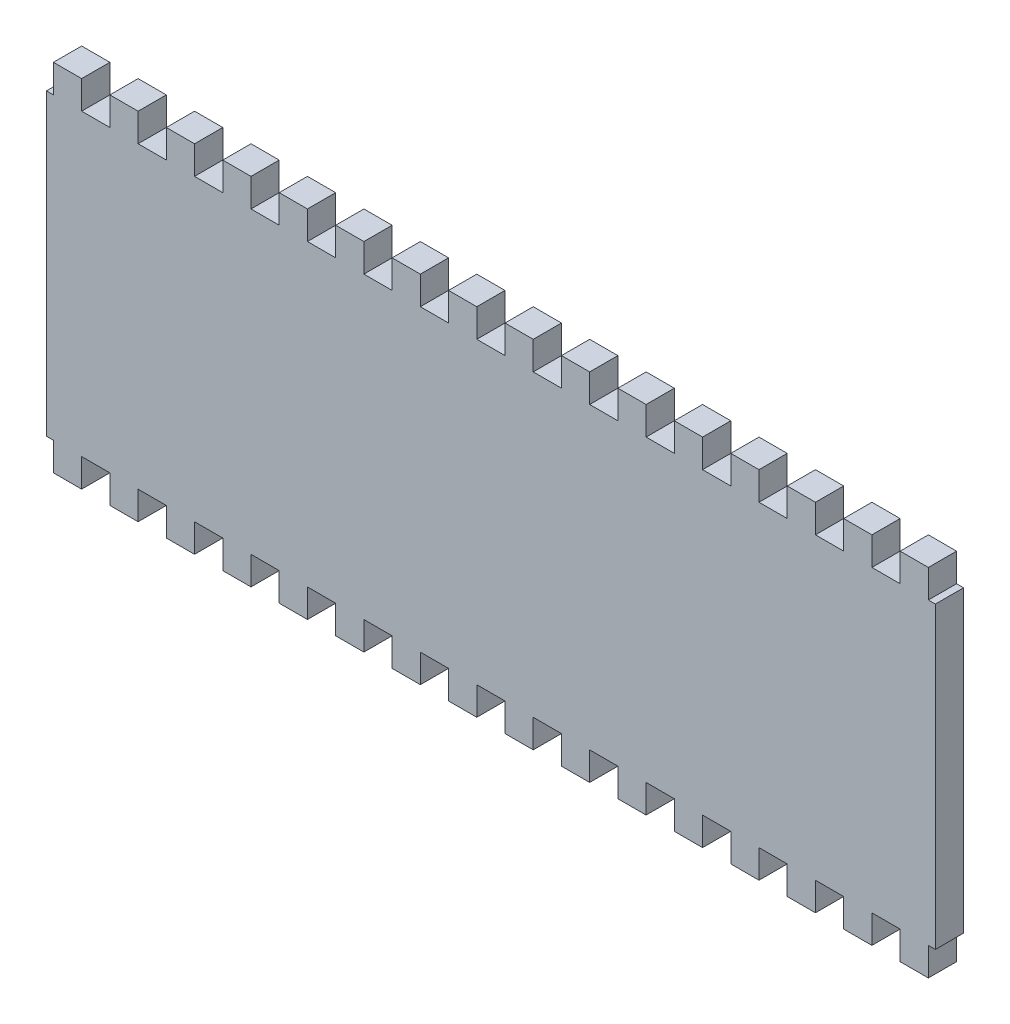
from build123d import *

# Parameters (mm, degrees)
SKETCH1_W                = 100
SKETCH1_H                = 40
BOSS_EXTRUDE1_DEPTH      = 3.175
SKETCH2_W                = 3.175
SKETCH2_H                = 6.35
CUT_EXTRUDE1_DEPTH       = 3.175
LPATTERN1_COUNT          = 10
LPATTERN1_PITCH          = 6.35
LPATTERN1_COUNT_DIR2     = 10
LPATTERN1_PITCH_DIR2     = 6.35
MIRROR1_COPY_1_SKETCH_W  = 3.175
MIRROR1_COPY_1_SKETCH_H  = 6.35
MIRROR1_COPY_1_DEPTH     = 3.175
MIRROR1_COPY_2_SKETCH_W  = 3.175
MIRROR1_COPY_2_SKETCH_H  = 6.35
MIRROR1_COPY_2_DEPTH     = 3.175
MIRROR1_COPY_3_SKETCH_W  = 3.175
MIRROR1_COPY_3_SKETCH_H  = 6.35
MIRROR1_COPY_3_DEPTH     = 3.175
MIRROR1_COPY_4_SKETCH_W  = 3.175
MIRROR1_COPY_4_SKETCH_H  = 6.35
MIRROR1_COPY_4_DEPTH     = 3.175
MIRROR1_COPY_5_SKETCH_W  = 3.175
MIRROR1_COPY_5_SKETCH_H  = 6.35
MIRROR1_COPY_5_DEPTH     = 3.175
MIRROR1_COPY_6_SKETCH_W  = 3.175
MIRROR1_COPY_6_SKETCH_H  = 6.35
MIRROR1_COPY_6_DEPTH     = 3.175
MIRROR1_COPY_7_SKETCH_W  = 3.175
MIRROR1_COPY_7_SKETCH_H  = 6.35
MIRROR1_COPY_7_DEPTH     = 3.175
MIRROR1_COPY_8_SKETCH_W  = 3.175
MIRROR1_COPY_8_SKETCH_H  = 6.35
MIRROR1_COPY_8_DEPTH     = 3.175
MIRROR1_COPY_9_SKETCH_W  = 3.175
MIRROR1_COPY_9_SKETCH_H  = 6.35
MIRROR1_COPY_9_DEPTH     = 3.175
MIRROR1_COPY_10_SKETCH_W = 3.175
MIRROR1_COPY_10_SKETCH_H = 6.35
MIRROR1_COPY_10_DEPTH    = 3.175
MIRROR1_COPY_11_SKETCH_W = 3.175
MIRROR1_COPY_11_SKETCH_H = 6.35
MIRROR1_COPY_11_DEPTH    = 3.175
MIRROR1_COPY_12_SKETCH_W = 3.175
MIRROR1_COPY_12_SKETCH_H = 6.35
MIRROR1_COPY_12_DEPTH    = 3.175
MIRROR1_COPY_13_SKETCH_W = 3.175
MIRROR1_COPY_13_SKETCH_H = 6.35
MIRROR1_COPY_13_DEPTH    = 3.175
MIRROR1_COPY_14_SKETCH_W = 3.175
MIRROR1_COPY_14_SKETCH_H = 6.35
MIRROR1_COPY_14_DEPTH    = 3.175
MIRROR1_COPY_15_SKETCH_W = 3.175
MIRROR1_COPY_15_SKETCH_H = 6.35
MIRROR1_COPY_15_DEPTH    = 3.175
MIRROR1_COPY_16_SKETCH_W = 3.175
MIRROR1_COPY_16_SKETCH_H = 6.35
MIRROR1_COPY_16_DEPTH    = 3.175
MIRROR1_COPY_17_SKETCH_W = 3.175
MIRROR1_COPY_17_SKETCH_H = 6.35
MIRROR1_COPY_17_DEPTH    = 3.175
MIRROR1_COPY_18_SKETCH_W = 3.175
MIRROR1_COPY_18_SKETCH_H = 6.35
MIRROR1_COPY_18_DEPTH    = 3.175
MIRROR1_COPY_19_SKETCH_W = 3.175
MIRROR1_COPY_19_SKETCH_H = 6.35
MIRROR1_COPY_19_DEPTH    = 3.175
MIRROR1_COPY_20_SKETCH_W = 3.175
MIRROR1_COPY_20_SKETCH_H = 6.35
MIRROR1_COPY_20_DEPTH    = 3.175
MIRROR1_COPY_21_SKETCH_W = 3.175
MIRROR1_COPY_21_SKETCH_H = 6.35
MIRROR1_COPY_21_DEPTH    = 3.175
MIRROR1_COPY_22_SKETCH_W = 3.175
MIRROR1_COPY_22_SKETCH_H = 6.35
MIRROR1_COPY_22_DEPTH    = 3.175
MIRROR1_COPY_23_SKETCH_W = 3.175
MIRROR1_COPY_23_SKETCH_H = 6.35
MIRROR1_COPY_23_DEPTH    = 3.175
MIRROR1_COPY_24_SKETCH_W = 3.175
MIRROR1_COPY_24_SKETCH_H = 6.35
MIRROR1_COPY_24_DEPTH    = 3.175
MIRROR1_COPY_25_SKETCH_W = 3.175
MIRROR1_COPY_25_SKETCH_H = 6.35
MIRROR1_COPY_25_DEPTH    = 3.175
MIRROR1_COPY_26_SKETCH_W = 3.175
MIRROR1_COPY_26_SKETCH_H = 6.35
MIRROR1_COPY_26_DEPTH    = 3.175
MIRROR1_COPY_27_SKETCH_W = 3.175
MIRROR1_COPY_27_SKETCH_H = 6.35
MIRROR1_COPY_27_DEPTH    = 3.175
MIRROR1_COPY_28_SKETCH_W = 3.175
MIRROR1_COPY_28_SKETCH_H = 6.35
MIRROR1_COPY_28_DEPTH    = 3.175
MIRROR1_COPY_29_SKETCH_W = 3.175
MIRROR1_COPY_29_SKETCH_H = 6.35
MIRROR1_COPY_29_DEPTH    = 3.175
MIRROR1_COPY_30_SKETCH_W = 3.175
MIRROR1_COPY_30_SKETCH_H = 6.35
MIRROR1_COPY_30_DEPTH    = 3.175
MIRROR1_COPY_31_SKETCH_W = 3.175
MIRROR1_COPY_31_SKETCH_H = 6.35
MIRROR1_COPY_31_DEPTH    = 3.175
MIRROR1_COPY_32_SKETCH_W = 3.175
MIRROR1_COPY_32_SKETCH_H = 6.35
MIRROR1_COPY_32_DEPTH    = 3.175
MIRROR1_COPY_33_SKETCH_W = 3.175
MIRROR1_COPY_33_SKETCH_H = 6.35
MIRROR1_COPY_33_DEPTH    = 3.175
MIRROR1_COPY_34_SKETCH_W = 3.175
MIRROR1_COPY_34_SKETCH_H = 6.35
MIRROR1_COPY_34_DEPTH    = 3.175
MIRROR1_COPY_35_SKETCH_W = 3.175
MIRROR1_COPY_35_SKETCH_H = 6.35
MIRROR1_COPY_35_DEPTH    = 3.175
MIRROR1_COPY_36_SKETCH_W = 3.175
MIRROR1_COPY_36_SKETCH_H = 6.35
MIRROR1_COPY_36_DEPTH    = 3.175
MIRROR1_COPY_37_SKETCH_W = 3.175
MIRROR1_COPY_37_SKETCH_H = 6.35
MIRROR1_COPY_37_DEPTH    = 3.175
MIRROR1_COPY_38_SKETCH_W = 3.175
MIRROR1_COPY_38_SKETCH_H = 6.35
MIRROR1_COPY_38_DEPTH    = 3.175
MIRROR1_COPY_39_SKETCH_W = 3.175
MIRROR1_COPY_39_SKETCH_H = 6.35
MIRROR1_COPY_39_DEPTH    = 3.175
MIRROR1_COPY_40_SKETCH_W = 3.175
MIRROR1_COPY_40_SKETCH_H = 6.35
MIRROR1_COPY_40_DEPTH    = 3.175
MIRROR1_COPY_41_SKETCH_W = 3.175
MIRROR1_COPY_41_SKETCH_H = 6.35
MIRROR1_COPY_41_DEPTH    = 3.175
MIRROR1_COPY_42_SKETCH_W = 3.175
MIRROR1_COPY_42_SKETCH_H = 6.35
MIRROR1_COPY_42_DEPTH    = 3.175
MIRROR1_COPY_43_SKETCH_W = 3.175
MIRROR1_COPY_43_SKETCH_H = 6.35
MIRROR1_COPY_43_DEPTH    = 3.175
MIRROR1_COPY_44_SKETCH_W = 3.175
MIRROR1_COPY_44_SKETCH_H = 6.35
MIRROR1_COPY_44_DEPTH    = 3.175
MIRROR1_COPY_45_SKETCH_W = 3.175
MIRROR1_COPY_45_SKETCH_H = 6.35
MIRROR1_COPY_45_DEPTH    = 3.175
MIRROR1_COPY_46_SKETCH_W = 3.175
MIRROR1_COPY_46_SKETCH_H = 6.35
MIRROR1_COPY_46_DEPTH    = 3.175
MIRROR1_COPY_47_SKETCH_W = 3.175
MIRROR1_COPY_47_SKETCH_H = 6.35
MIRROR1_COPY_47_DEPTH    = 3.175
MIRROR1_COPY_48_SKETCH_W = 3.175
MIRROR1_COPY_48_SKETCH_H = 6.35
MIRROR1_COPY_48_DEPTH    = 3.175
MIRROR1_COPY_49_SKETCH_W = 3.175
MIRROR1_COPY_49_SKETCH_H = 6.35
MIRROR1_COPY_49_DEPTH    = 3.175
MIRROR1_COPY_50_SKETCH_W = 3.175
MIRROR1_COPY_50_SKETCH_H = 6.35
MIRROR1_COPY_50_DEPTH    = 3.175
MIRROR1_COPY_51_SKETCH_W = 3.175
MIRROR1_COPY_51_SKETCH_H = 6.35
MIRROR1_COPY_51_DEPTH    = 3.175
MIRROR1_COPY_52_SKETCH_W = 3.175
MIRROR1_COPY_52_SKETCH_H = 6.35
MIRROR1_COPY_52_DEPTH    = 3.175
MIRROR1_COPY_53_SKETCH_W = 3.175
MIRROR1_COPY_53_SKETCH_H = 6.35
MIRROR1_COPY_53_DEPTH    = 3.175
MIRROR1_COPY_54_SKETCH_W = 3.175
MIRROR1_COPY_54_SKETCH_H = 6.35
MIRROR1_COPY_54_DEPTH    = 3.175
MIRROR1_COPY_55_SKETCH_W = 3.175
MIRROR1_COPY_55_SKETCH_H = 6.35
MIRROR1_COPY_55_DEPTH    = 3.175
MIRROR1_COPY_56_SKETCH_W = 3.175
MIRROR1_COPY_56_SKETCH_H = 6.35
MIRROR1_COPY_56_DEPTH    = 3.175
MIRROR1_COPY_57_SKETCH_W = 3.175
MIRROR1_COPY_57_SKETCH_H = 6.35
MIRROR1_COPY_57_DEPTH    = 3.175
MIRROR1_COPY_58_SKETCH_W = 3.175
MIRROR1_COPY_58_SKETCH_H = 6.35
MIRROR1_COPY_58_DEPTH    = 3.175
MIRROR1_COPY_59_SKETCH_W = 3.175
MIRROR1_COPY_59_SKETCH_H = 6.35
MIRROR1_COPY_59_DEPTH    = 3.175
MIRROR1_COPY_60_SKETCH_W = 3.175
MIRROR1_COPY_60_SKETCH_H = 6.35
MIRROR1_COPY_60_DEPTH    = 3.175
MIRROR1_COPY_61_SKETCH_W = 3.175
MIRROR1_COPY_61_SKETCH_H = 6.35
MIRROR1_COPY_61_DEPTH    = 3.175
MIRROR1_COPY_62_SKETCH_W = 3.175
MIRROR1_COPY_62_SKETCH_H = 6.35
MIRROR1_COPY_62_DEPTH    = 3.175
MIRROR1_COPY_63_SKETCH_W = 3.175
MIRROR1_COPY_63_SKETCH_H = 6.35
MIRROR1_COPY_63_DEPTH    = 3.175
MIRROR1_COPY_64_SKETCH_W = 3.175
MIRROR1_COPY_64_SKETCH_H = 6.35
MIRROR1_COPY_64_DEPTH    = 3.175
MIRROR1_COPY_65_SKETCH_W = 3.175
MIRROR1_COPY_65_SKETCH_H = 6.35
MIRROR1_COPY_65_DEPTH    = 3.175
MIRROR1_COPY_66_SKETCH_W = 3.175
MIRROR1_COPY_66_SKETCH_H = 6.35
MIRROR1_COPY_66_DEPTH    = 3.175
MIRROR1_COPY_67_SKETCH_W = 3.175
MIRROR1_COPY_67_SKETCH_H = 6.35
MIRROR1_COPY_67_DEPTH    = 3.175
MIRROR1_COPY_68_SKETCH_W = 3.175
MIRROR1_COPY_68_SKETCH_H = 6.35
MIRROR1_COPY_68_DEPTH    = 3.175
MIRROR1_COPY_69_SKETCH_W = 3.175
MIRROR1_COPY_69_SKETCH_H = 6.35
MIRROR1_COPY_69_DEPTH    = 3.175
MIRROR1_COPY_70_SKETCH_W = 3.175
MIRROR1_COPY_70_SKETCH_H = 6.35
MIRROR1_COPY_70_DEPTH    = 3.175
MIRROR1_COPY_71_SKETCH_W = 3.175
MIRROR1_COPY_71_SKETCH_H = 6.35
MIRROR1_COPY_71_DEPTH    = 3.175
MIRROR1_COPY_72_SKETCH_W = 3.175
MIRROR1_COPY_72_SKETCH_H = 6.35
MIRROR1_COPY_72_DEPTH    = 3.175
MIRROR1_COPY_73_SKETCH_W = 3.175
MIRROR1_COPY_73_SKETCH_H = 6.35
MIRROR1_COPY_73_DEPTH    = 3.175
MIRROR1_COPY_74_SKETCH_W = 3.175
MIRROR1_COPY_74_SKETCH_H = 6.35
MIRROR1_COPY_74_DEPTH    = 3.175
MIRROR1_COPY_75_SKETCH_W = 3.175
MIRROR1_COPY_75_SKETCH_H = 6.35
MIRROR1_COPY_75_DEPTH    = 3.175
MIRROR1_COPY_76_SKETCH_W = 3.175
MIRROR1_COPY_76_SKETCH_H = 6.35
MIRROR1_COPY_76_DEPTH    = 3.175
MIRROR1_COPY_77_SKETCH_W = 3.175
MIRROR1_COPY_77_SKETCH_H = 6.35
MIRROR1_COPY_77_DEPTH    = 3.175
MIRROR1_COPY_78_SKETCH_W = 3.175
MIRROR1_COPY_78_SKETCH_H = 6.35
MIRROR1_COPY_78_DEPTH    = 3.175
MIRROR1_COPY_79_SKETCH_W = 3.175
MIRROR1_COPY_79_SKETCH_H = 6.35
MIRROR1_COPY_79_DEPTH    = 3.175
MIRROR1_COPY_80_SKETCH_W = 3.175
MIRROR1_COPY_80_SKETCH_H = 6.35
MIRROR1_COPY_80_DEPTH    = 3.175
MIRROR1_COPY_81_SKETCH_W = 3.175
MIRROR1_COPY_81_SKETCH_H = 6.35
MIRROR1_COPY_81_DEPTH    = 3.175
MIRROR1_COPY_82_SKETCH_W = 3.175
MIRROR1_COPY_82_SKETCH_H = 6.35
MIRROR1_COPY_82_DEPTH    = 3.175
MIRROR1_COPY_83_SKETCH_W = 3.175
MIRROR1_COPY_83_SKETCH_H = 6.35
MIRROR1_COPY_83_DEPTH    = 3.175
MIRROR1_COPY_84_SKETCH_W = 3.175
MIRROR1_COPY_84_SKETCH_H = 6.35
MIRROR1_COPY_84_DEPTH    = 3.175
MIRROR1_COPY_85_SKETCH_W = 3.175
MIRROR1_COPY_85_SKETCH_H = 6.35
MIRROR1_COPY_85_DEPTH    = 3.175
MIRROR1_COPY_86_SKETCH_W = 3.175
MIRROR1_COPY_86_SKETCH_H = 6.35
MIRROR1_COPY_86_DEPTH    = 3.175
MIRROR1_COPY_87_SKETCH_W = 3.175
MIRROR1_COPY_87_SKETCH_H = 6.35
MIRROR1_COPY_87_DEPTH    = 3.175
MIRROR1_COPY_88_SKETCH_W = 3.175
MIRROR1_COPY_88_SKETCH_H = 6.35
MIRROR1_COPY_88_DEPTH    = 3.175
MIRROR1_COPY_89_SKETCH_W = 3.175
MIRROR1_COPY_89_SKETCH_H = 6.35
MIRROR1_COPY_89_DEPTH    = 3.175
MIRROR1_COPY_90_SKETCH_W = 3.175
MIRROR1_COPY_90_SKETCH_H = 6.35
MIRROR1_COPY_90_DEPTH    = 3.175
MIRROR1_COPY_91_SKETCH_W = 3.175
MIRROR1_COPY_91_SKETCH_H = 6.35
MIRROR1_COPY_91_DEPTH    = 3.175
MIRROR1_COPY_92_SKETCH_W = 3.175
MIRROR1_COPY_92_SKETCH_H = 6.35
MIRROR1_COPY_92_DEPTH    = 3.175
MIRROR1_COPY_93_SKETCH_W = 3.175
MIRROR1_COPY_93_SKETCH_H = 6.35
MIRROR1_COPY_93_DEPTH    = 3.175
MIRROR1_COPY_94_SKETCH_W = 3.175
MIRROR1_COPY_94_SKETCH_H = 6.35
MIRROR1_COPY_94_DEPTH    = 3.175
MIRROR1_COPY_95_SKETCH_W = 3.175
MIRROR1_COPY_95_SKETCH_H = 6.35
MIRROR1_COPY_95_DEPTH    = 3.175
MIRROR1_COPY_96_SKETCH_W = 3.175
MIRROR1_COPY_96_SKETCH_H = 6.35
MIRROR1_COPY_96_DEPTH    = 3.175
MIRROR1_COPY_97_SKETCH_W = 3.175
MIRROR1_COPY_97_SKETCH_H = 6.35
MIRROR1_COPY_97_DEPTH    = 3.175
MIRROR1_COPY_98_SKETCH_W = 3.175
MIRROR1_COPY_98_SKETCH_H = 6.35
MIRROR1_COPY_98_DEPTH    = 3.175
MIRROR1_COPY_99_SKETCH_W = 3.175
MIRROR1_COPY_99_SKETCH_H = 6.35
MIRROR1_COPY_99_DEPTH    = 3.175


with BuildPart() as part:
    # Sketch1 → Boss-Extrude1 (new body)
    with BuildSketch(Plane.XY):
        Rectangle(SKETCH1_W, SKETCH1_H)
    extrude(amount=BOSS_EXTRUDE1_DEPTH)

    # Sketch2 → Cut-Extrude1 (cut)
    with BuildSketch(Plane.XY.offset(3.175)):
        with Locations((0, -20)):
            Rectangle(SKETCH2_W, SKETCH2_H)
    cut_extrude1 = extrude(amount=-CUT_EXTRUDE1_DEPTH, mode=Mode.SUBTRACT)

    # LPattern1: Cut-Extrude1 10 × 10
    with Locations(*[Vector(1, 0, 0) * (i * LPATTERN1_PITCH) + Vector(-1, 0, 0) * (j * LPATTERN1_PITCH_DIR2) for i in range(LPATTERN1_COUNT) for j in range(LPATTERN1_COUNT_DIR2) if (i, j) != (0, 0)]):
        add(cut_extrude1, mode=Mode.SUBTRACT)

    # Mirror1: Cut-Extrude1 across plane
    add(cut_extrude1.mirror(Plane.ZX), mode=Mode.SUBTRACT)

    # Mirror1 copy 1 sketch → Mirror1 copy 1 (cut)
    with BuildSketch(Plane(origin=(-6.35, 0, 3.175), x_dir=(1, 0, 0), z_dir=(0, 0, 1))):
        with Locations((0, 20)):
            Rectangle(MIRROR1_COPY_1_SKETCH_W, MIRROR1_COPY_1_SKETCH_H)
    extrude(amount=-MIRROR1_COPY_1_DEPTH, mode=Mode.SUBTRACT)

    # Mirror1 copy 2 sketch → Mirror1 copy 2 (cut)
    with BuildSketch(Plane(origin=(-12.7, 0, 3.175), x_dir=(1, 0, 0), z_dir=(0, 0, 1))):
        with Locations((0, 20)):
            Rectangle(MIRROR1_COPY_2_SKETCH_W, MIRROR1_COPY_2_SKETCH_H)
    extrude(amount=-MIRROR1_COPY_2_DEPTH, mode=Mode.SUBTRACT)

    # Mirror1 copy 3 sketch → Mirror1 copy 3 (cut)
    with BuildSketch(Plane(origin=(-19.05, 0, 3.175), x_dir=(1, 0, 0), z_dir=(0, 0, 1))):
        with Locations((0, 20)):
            Rectangle(MIRROR1_COPY_3_SKETCH_W, MIRROR1_COPY_3_SKETCH_H)
    extrude(amount=-MIRROR1_COPY_3_DEPTH, mode=Mode.SUBTRACT)

    # Mirror1 copy 4 sketch → Mirror1 copy 4 (cut)
    with BuildSketch(Plane(origin=(-25.4, 0, 3.175), x_dir=(1, 0, 0), z_dir=(0, 0, 1))):
        with Locations((0, 20)):
            Rectangle(MIRROR1_COPY_4_SKETCH_W, MIRROR1_COPY_4_SKETCH_H)
    extrude(amount=-MIRROR1_COPY_4_DEPTH, mode=Mode.SUBTRACT)

    # Mirror1 copy 5 sketch → Mirror1 copy 5 (cut)
    with BuildSketch(Plane(origin=(-31.75, 0, 3.175), x_dir=(1, 0, 0), z_dir=(0, 0, 1))):
        with Locations((0, 20)):
            Rectangle(MIRROR1_COPY_5_SKETCH_W, MIRROR1_COPY_5_SKETCH_H)
    extrude(amount=-MIRROR1_COPY_5_DEPTH, mode=Mode.SUBTRACT)

    # Mirror1 copy 6 sketch → Mirror1 copy 6 (cut)
    with BuildSketch(Plane(origin=(-38.1, 0, 3.175), x_dir=(1, 0, 0), z_dir=(0, 0, 1))):
        with Locations((0, 20)):
            Rectangle(MIRROR1_COPY_6_SKETCH_W, MIRROR1_COPY_6_SKETCH_H)
    extrude(amount=-MIRROR1_COPY_6_DEPTH, mode=Mode.SUBTRACT)

    # Mirror1 copy 7 sketch → Mirror1 copy 7 (cut)
    with BuildSketch(Plane(origin=(-44.45, 0, 3.175), x_dir=(1, 0, 0), z_dir=(0, 0, 1))):
        with Locations((0, 20)):
            Rectangle(MIRROR1_COPY_7_SKETCH_W, MIRROR1_COPY_7_SKETCH_H)
    extrude(amount=-MIRROR1_COPY_7_DEPTH, mode=Mode.SUBTRACT)

    # Mirror1 copy 8 sketch → Mirror1 copy 8 (cut)
    with BuildSketch(Plane(origin=(-50.8, 0, 3.175), x_dir=(1, 0, 0), z_dir=(0, 0, 1))):
        with Locations((0, 20)):
            Rectangle(MIRROR1_COPY_8_SKETCH_W, MIRROR1_COPY_8_SKETCH_H)
    extrude(amount=-MIRROR1_COPY_8_DEPTH, mode=Mode.SUBTRACT)

    # Mirror1 copy 9 sketch → Mirror1 copy 9 (cut)
    with BuildSketch(Plane(origin=(-57.15, 0, 3.175), x_dir=(1, 0, 0), z_dir=(0, 0, 1))):
        with Locations((0, 20)):
            Rectangle(MIRROR1_COPY_9_SKETCH_W, MIRROR1_COPY_9_SKETCH_H)
    extrude(amount=-MIRROR1_COPY_9_DEPTH, mode=Mode.SUBTRACT)

    # Mirror1 copy 10 sketch → Mirror1 copy 10 (cut)
    with BuildSketch(Plane(origin=(6.35, 0, 3.175), x_dir=(1, 0, 0), z_dir=(0, 0, 1))):
        with Locations((0, 20)):
            Rectangle(MIRROR1_COPY_10_SKETCH_W, MIRROR1_COPY_10_SKETCH_H)
    extrude(amount=-MIRROR1_COPY_10_DEPTH, mode=Mode.SUBTRACT)

    # Mirror1 copy 11 sketch → Mirror1 copy 11 (cut)
    with BuildSketch(Plane.XY.offset(3.175)):
        with Locations((0, 20)):
            Rectangle(MIRROR1_COPY_11_SKETCH_W, MIRROR1_COPY_11_SKETCH_H)
    extrude(amount=-MIRROR1_COPY_11_DEPTH, mode=Mode.SUBTRACT)

    # Mirror1 copy 12 sketch → Mirror1 copy 12 (cut)
    with BuildSketch(Plane(origin=(-6.35, 0, 3.175), x_dir=(1, 0, 0), z_dir=(0, 0, 1))):
        with Locations((0, 20)):
            Rectangle(MIRROR1_COPY_12_SKETCH_W, MIRROR1_COPY_12_SKETCH_H)
    extrude(amount=-MIRROR1_COPY_12_DEPTH, mode=Mode.SUBTRACT)

    # Mirror1 copy 13 sketch → Mirror1 copy 13 (cut)
    with BuildSketch(Plane(origin=(-12.7, 0, 3.175), x_dir=(1, 0, 0), z_dir=(0, 0, 1))):
        with Locations((0, 20)):
            Rectangle(MIRROR1_COPY_13_SKETCH_W, MIRROR1_COPY_13_SKETCH_H)
    extrude(amount=-MIRROR1_COPY_13_DEPTH, mode=Mode.SUBTRACT)

    # Mirror1 copy 14 sketch → Mirror1 copy 14 (cut)
    with BuildSketch(Plane(origin=(-19.05, 0, 3.175), x_dir=(1, 0, 0), z_dir=(0, 0, 1))):
        with Locations((0, 20)):
            Rectangle(MIRROR1_COPY_14_SKETCH_W, MIRROR1_COPY_14_SKETCH_H)
    extrude(amount=-MIRROR1_COPY_14_DEPTH, mode=Mode.SUBTRACT)

    # Mirror1 copy 15 sketch → Mirror1 copy 15 (cut)
    with BuildSketch(Plane(origin=(-25.4, 0, 3.175), x_dir=(1, 0, 0), z_dir=(0, 0, 1))):
        with Locations((0, 20)):
            Rectangle(MIRROR1_COPY_15_SKETCH_W, MIRROR1_COPY_15_SKETCH_H)
    extrude(amount=-MIRROR1_COPY_15_DEPTH, mode=Mode.SUBTRACT)

    # Mirror1 copy 16 sketch → Mirror1 copy 16 (cut)
    with BuildSketch(Plane(origin=(-31.75, 0, 3.175), x_dir=(1, 0, 0), z_dir=(0, 0, 1))):
        with Locations((0, 20)):
            Rectangle(MIRROR1_COPY_16_SKETCH_W, MIRROR1_COPY_16_SKETCH_H)
    extrude(amount=-MIRROR1_COPY_16_DEPTH, mode=Mode.SUBTRACT)

    # Mirror1 copy 17 sketch → Mirror1 copy 17 (cut)
    with BuildSketch(Plane(origin=(-38.1, 0, 3.175), x_dir=(1, 0, 0), z_dir=(0, 0, 1))):
        with Locations((0, 20)):
            Rectangle(MIRROR1_COPY_17_SKETCH_W, MIRROR1_COPY_17_SKETCH_H)
    extrude(amount=-MIRROR1_COPY_17_DEPTH, mode=Mode.SUBTRACT)

    # Mirror1 copy 18 sketch → Mirror1 copy 18 (cut)
    with BuildSketch(Plane(origin=(-44.45, 0, 3.175), x_dir=(1, 0, 0), z_dir=(0, 0, 1))):
        with Locations((0, 20)):
            Rectangle(MIRROR1_COPY_18_SKETCH_W, MIRROR1_COPY_18_SKETCH_H)
    extrude(amount=-MIRROR1_COPY_18_DEPTH, mode=Mode.SUBTRACT)

    # Mirror1 copy 19 sketch → Mirror1 copy 19 (cut)
    with BuildSketch(Plane(origin=(-50.8, 0, 3.175), x_dir=(1, 0, 0), z_dir=(0, 0, 1))):
        with Locations((0, 20)):
            Rectangle(MIRROR1_COPY_19_SKETCH_W, MIRROR1_COPY_19_SKETCH_H)
    extrude(amount=-MIRROR1_COPY_19_DEPTH, mode=Mode.SUBTRACT)

    # Mirror1 copy 20 sketch → Mirror1 copy 20 (cut)
    with BuildSketch(Plane(origin=(12.7, 0, 3.175), x_dir=(1, 0, 0), z_dir=(0, 0, 1))):
        with Locations((0, 20)):
            Rectangle(MIRROR1_COPY_20_SKETCH_W, MIRROR1_COPY_20_SKETCH_H)
    extrude(amount=-MIRROR1_COPY_20_DEPTH, mode=Mode.SUBTRACT)

    # Mirror1 copy 21 sketch → Mirror1 copy 21 (cut)
    with BuildSketch(Plane(origin=(6.35, 0, 3.175), x_dir=(1, 0, 0), z_dir=(0, 0, 1))):
        with Locations((0, 20)):
            Rectangle(MIRROR1_COPY_21_SKETCH_W, MIRROR1_COPY_21_SKETCH_H)
    extrude(amount=-MIRROR1_COPY_21_DEPTH, mode=Mode.SUBTRACT)

    # Mirror1 copy 22 sketch → Mirror1 copy 22 (cut)
    with BuildSketch(Plane.XY.offset(3.175)):
        with Locations((0, 20)):
            Rectangle(MIRROR1_COPY_22_SKETCH_W, MIRROR1_COPY_22_SKETCH_H)
    extrude(amount=-MIRROR1_COPY_22_DEPTH, mode=Mode.SUBTRACT)

    # Mirror1 copy 23 sketch → Mirror1 copy 23 (cut)
    with BuildSketch(Plane(origin=(-6.35, 0, 3.175), x_dir=(1, 0, 0), z_dir=(0, 0, 1))):
        with Locations((0, 20)):
            Rectangle(MIRROR1_COPY_23_SKETCH_W, MIRROR1_COPY_23_SKETCH_H)
    extrude(amount=-MIRROR1_COPY_23_DEPTH, mode=Mode.SUBTRACT)

    # Mirror1 copy 24 sketch → Mirror1 copy 24 (cut)
    with BuildSketch(Plane(origin=(-12.7, 0, 3.175), x_dir=(1, 0, 0), z_dir=(0, 0, 1))):
        with Locations((0, 20)):
            Rectangle(MIRROR1_COPY_24_SKETCH_W, MIRROR1_COPY_24_SKETCH_H)
    extrude(amount=-MIRROR1_COPY_24_DEPTH, mode=Mode.SUBTRACT)

    # Mirror1 copy 25 sketch → Mirror1 copy 25 (cut)
    with BuildSketch(Plane(origin=(-19.05, 0, 3.175), x_dir=(1, 0, 0), z_dir=(0, 0, 1))):
        with Locations((0, 20)):
            Rectangle(MIRROR1_COPY_25_SKETCH_W, MIRROR1_COPY_25_SKETCH_H)
    extrude(amount=-MIRROR1_COPY_25_DEPTH, mode=Mode.SUBTRACT)

    # Mirror1 copy 26 sketch → Mirror1 copy 26 (cut)
    with BuildSketch(Plane(origin=(-25.4, 0, 3.175), x_dir=(1, 0, 0), z_dir=(0, 0, 1))):
        with Locations((0, 20)):
            Rectangle(MIRROR1_COPY_26_SKETCH_W, MIRROR1_COPY_26_SKETCH_H)
    extrude(amount=-MIRROR1_COPY_26_DEPTH, mode=Mode.SUBTRACT)

    # Mirror1 copy 27 sketch → Mirror1 copy 27 (cut)
    with BuildSketch(Plane(origin=(-31.75, 0, 3.175), x_dir=(1, 0, 0), z_dir=(0, 0, 1))):
        with Locations((0, 20)):
            Rectangle(MIRROR1_COPY_27_SKETCH_W, MIRROR1_COPY_27_SKETCH_H)
    extrude(amount=-MIRROR1_COPY_27_DEPTH, mode=Mode.SUBTRACT)

    # Mirror1 copy 28 sketch → Mirror1 copy 28 (cut)
    with BuildSketch(Plane(origin=(-38.1, 0, 3.175), x_dir=(1, 0, 0), z_dir=(0, 0, 1))):
        with Locations((0, 20)):
            Rectangle(MIRROR1_COPY_28_SKETCH_W, MIRROR1_COPY_28_SKETCH_H)
    extrude(amount=-MIRROR1_COPY_28_DEPTH, mode=Mode.SUBTRACT)

    # Mirror1 copy 29 sketch → Mirror1 copy 29 (cut)
    with BuildSketch(Plane(origin=(-44.45, 0, 3.175), x_dir=(1, 0, 0), z_dir=(0, 0, 1))):
        with Locations((0, 20)):
            Rectangle(MIRROR1_COPY_29_SKETCH_W, MIRROR1_COPY_29_SKETCH_H)
    extrude(amount=-MIRROR1_COPY_29_DEPTH, mode=Mode.SUBTRACT)

    # Mirror1 copy 30 sketch → Mirror1 copy 30 (cut)
    with BuildSketch(Plane(origin=(19.05, 0, 3.175), x_dir=(1, 0, 0), z_dir=(0, 0, 1))):
        with Locations((0, 20)):
            Rectangle(MIRROR1_COPY_30_SKETCH_W, MIRROR1_COPY_30_SKETCH_H)
    extrude(amount=-MIRROR1_COPY_30_DEPTH, mode=Mode.SUBTRACT)

    # Mirror1 copy 31 sketch → Mirror1 copy 31 (cut)
    with BuildSketch(Plane(origin=(12.7, 0, 3.175), x_dir=(1, 0, 0), z_dir=(0, 0, 1))):
        with Locations((0, 20)):
            Rectangle(MIRROR1_COPY_31_SKETCH_W, MIRROR1_COPY_31_SKETCH_H)
    extrude(amount=-MIRROR1_COPY_31_DEPTH, mode=Mode.SUBTRACT)

    # Mirror1 copy 32 sketch → Mirror1 copy 32 (cut)
    with BuildSketch(Plane(origin=(6.35, 0, 3.175), x_dir=(1, 0, 0), z_dir=(0, 0, 1))):
        with Locations((0, 20)):
            Rectangle(MIRROR1_COPY_32_SKETCH_W, MIRROR1_COPY_32_SKETCH_H)
    extrude(amount=-MIRROR1_COPY_32_DEPTH, mode=Mode.SUBTRACT)

    # Mirror1 copy 33 sketch → Mirror1 copy 33 (cut)
    with BuildSketch(Plane.XY.offset(3.175)):
        with Locations((0, 20)):
            Rectangle(MIRROR1_COPY_33_SKETCH_W, MIRROR1_COPY_33_SKETCH_H)
    extrude(amount=-MIRROR1_COPY_33_DEPTH, mode=Mode.SUBTRACT)

    # Mirror1 copy 34 sketch → Mirror1 copy 34 (cut)
    with BuildSketch(Plane(origin=(-6.35, 0, 3.175), x_dir=(1, 0, 0), z_dir=(0, 0, 1))):
        with Locations((0, 20)):
            Rectangle(MIRROR1_COPY_34_SKETCH_W, MIRROR1_COPY_34_SKETCH_H)
    extrude(amount=-MIRROR1_COPY_34_DEPTH, mode=Mode.SUBTRACT)

    # Mirror1 copy 35 sketch → Mirror1 copy 35 (cut)
    with BuildSketch(Plane(origin=(-12.7, 0, 3.175), x_dir=(1, 0, 0), z_dir=(0, 0, 1))):
        with Locations((0, 20)):
            Rectangle(MIRROR1_COPY_35_SKETCH_W, MIRROR1_COPY_35_SKETCH_H)
    extrude(amount=-MIRROR1_COPY_35_DEPTH, mode=Mode.SUBTRACT)

    # Mirror1 copy 36 sketch → Mirror1 copy 36 (cut)
    with BuildSketch(Plane(origin=(-19.05, 0, 3.175), x_dir=(1, 0, 0), z_dir=(0, 0, 1))):
        with Locations((0, 20)):
            Rectangle(MIRROR1_COPY_36_SKETCH_W, MIRROR1_COPY_36_SKETCH_H)
    extrude(amount=-MIRROR1_COPY_36_DEPTH, mode=Mode.SUBTRACT)

    # Mirror1 copy 37 sketch → Mirror1 copy 37 (cut)
    with BuildSketch(Plane(origin=(-25.4, 0, 3.175), x_dir=(1, 0, 0), z_dir=(0, 0, 1))):
        with Locations((0, 20)):
            Rectangle(MIRROR1_COPY_37_SKETCH_W, MIRROR1_COPY_37_SKETCH_H)
    extrude(amount=-MIRROR1_COPY_37_DEPTH, mode=Mode.SUBTRACT)

    # Mirror1 copy 38 sketch → Mirror1 copy 38 (cut)
    with BuildSketch(Plane(origin=(-31.75, 0, 3.175), x_dir=(1, 0, 0), z_dir=(0, 0, 1))):
        with Locations((0, 20)):
            Rectangle(MIRROR1_COPY_38_SKETCH_W, MIRROR1_COPY_38_SKETCH_H)
    extrude(amount=-MIRROR1_COPY_38_DEPTH, mode=Mode.SUBTRACT)

    # Mirror1 copy 39 sketch → Mirror1 copy 39 (cut)
    with BuildSketch(Plane(origin=(-38.1, 0, 3.175), x_dir=(1, 0, 0), z_dir=(0, 0, 1))):
        with Locations((0, 20)):
            Rectangle(MIRROR1_COPY_39_SKETCH_W, MIRROR1_COPY_39_SKETCH_H)
    extrude(amount=-MIRROR1_COPY_39_DEPTH, mode=Mode.SUBTRACT)

    # Mirror1 copy 40 sketch → Mirror1 copy 40 (cut)
    with BuildSketch(Plane(origin=(25.4, 0, 3.175), x_dir=(1, 0, 0), z_dir=(0, 0, 1))):
        with Locations((0, 20)):
            Rectangle(MIRROR1_COPY_40_SKETCH_W, MIRROR1_COPY_40_SKETCH_H)
    extrude(amount=-MIRROR1_COPY_40_DEPTH, mode=Mode.SUBTRACT)

    # Mirror1 copy 41 sketch → Mirror1 copy 41 (cut)
    with BuildSketch(Plane(origin=(19.05, 0, 3.175), x_dir=(1, 0, 0), z_dir=(0, 0, 1))):
        with Locations((0, 20)):
            Rectangle(MIRROR1_COPY_41_SKETCH_W, MIRROR1_COPY_41_SKETCH_H)
    extrude(amount=-MIRROR1_COPY_41_DEPTH, mode=Mode.SUBTRACT)

    # Mirror1 copy 42 sketch → Mirror1 copy 42 (cut)
    with BuildSketch(Plane(origin=(12.7, 0, 3.175), x_dir=(1, 0, 0), z_dir=(0, 0, 1))):
        with Locations((0, 20)):
            Rectangle(MIRROR1_COPY_42_SKETCH_W, MIRROR1_COPY_42_SKETCH_H)
    extrude(amount=-MIRROR1_COPY_42_DEPTH, mode=Mode.SUBTRACT)

    # Mirror1 copy 43 sketch → Mirror1 copy 43 (cut)
    with BuildSketch(Plane(origin=(6.35, 0, 3.175), x_dir=(1, 0, 0), z_dir=(0, 0, 1))):
        with Locations((0, 20)):
            Rectangle(MIRROR1_COPY_43_SKETCH_W, MIRROR1_COPY_43_SKETCH_H)
    extrude(amount=-MIRROR1_COPY_43_DEPTH, mode=Mode.SUBTRACT)

    # Mirror1 copy 44 sketch → Mirror1 copy 44 (cut)
    with BuildSketch(Plane.XY.offset(3.175)):
        with Locations((0, 20)):
            Rectangle(MIRROR1_COPY_44_SKETCH_W, MIRROR1_COPY_44_SKETCH_H)
    extrude(amount=-MIRROR1_COPY_44_DEPTH, mode=Mode.SUBTRACT)

    # Mirror1 copy 45 sketch → Mirror1 copy 45 (cut)
    with BuildSketch(Plane(origin=(-6.35, 0, 3.175), x_dir=(1, 0, 0), z_dir=(0, 0, 1))):
        with Locations((0, 20)):
            Rectangle(MIRROR1_COPY_45_SKETCH_W, MIRROR1_COPY_45_SKETCH_H)
    extrude(amount=-MIRROR1_COPY_45_DEPTH, mode=Mode.SUBTRACT)

    # Mirror1 copy 46 sketch → Mirror1 copy 46 (cut)
    with BuildSketch(Plane(origin=(-12.7, 0, 3.175), x_dir=(1, 0, 0), z_dir=(0, 0, 1))):
        with Locations((0, 20)):
            Rectangle(MIRROR1_COPY_46_SKETCH_W, MIRROR1_COPY_46_SKETCH_H)
    extrude(amount=-MIRROR1_COPY_46_DEPTH, mode=Mode.SUBTRACT)

    # Mirror1 copy 47 sketch → Mirror1 copy 47 (cut)
    with BuildSketch(Plane(origin=(-19.05, 0, 3.175), x_dir=(1, 0, 0), z_dir=(0, 0, 1))):
        with Locations((0, 20)):
            Rectangle(MIRROR1_COPY_47_SKETCH_W, MIRROR1_COPY_47_SKETCH_H)
    extrude(amount=-MIRROR1_COPY_47_DEPTH, mode=Mode.SUBTRACT)

    # Mirror1 copy 48 sketch → Mirror1 copy 48 (cut)
    with BuildSketch(Plane(origin=(-25.4, 0, 3.175), x_dir=(1, 0, 0), z_dir=(0, 0, 1))):
        with Locations((0, 20)):
            Rectangle(MIRROR1_COPY_48_SKETCH_W, MIRROR1_COPY_48_SKETCH_H)
    extrude(amount=-MIRROR1_COPY_48_DEPTH, mode=Mode.SUBTRACT)

    # Mirror1 copy 49 sketch → Mirror1 copy 49 (cut)
    with BuildSketch(Plane(origin=(-31.75, 0, 3.175), x_dir=(1, 0, 0), z_dir=(0, 0, 1))):
        with Locations((0, 20)):
            Rectangle(MIRROR1_COPY_49_SKETCH_W, MIRROR1_COPY_49_SKETCH_H)
    extrude(amount=-MIRROR1_COPY_49_DEPTH, mode=Mode.SUBTRACT)

    # Mirror1 copy 50 sketch → Mirror1 copy 50 (cut)
    with BuildSketch(Plane(origin=(31.75, 0, 3.175), x_dir=(1, 0, 0), z_dir=(0, 0, 1))):
        with Locations((0, 20)):
            Rectangle(MIRROR1_COPY_50_SKETCH_W, MIRROR1_COPY_50_SKETCH_H)
    extrude(amount=-MIRROR1_COPY_50_DEPTH, mode=Mode.SUBTRACT)

    # Mirror1 copy 51 sketch → Mirror1 copy 51 (cut)
    with BuildSketch(Plane(origin=(25.4, 0, 3.175), x_dir=(1, 0, 0), z_dir=(0, 0, 1))):
        with Locations((0, 20)):
            Rectangle(MIRROR1_COPY_51_SKETCH_W, MIRROR1_COPY_51_SKETCH_H)
    extrude(amount=-MIRROR1_COPY_51_DEPTH, mode=Mode.SUBTRACT)

    # Mirror1 copy 52 sketch → Mirror1 copy 52 (cut)
    with BuildSketch(Plane(origin=(19.05, 0, 3.175), x_dir=(1, 0, 0), z_dir=(0, 0, 1))):
        with Locations((0, 20)):
            Rectangle(MIRROR1_COPY_52_SKETCH_W, MIRROR1_COPY_52_SKETCH_H)
    extrude(amount=-MIRROR1_COPY_52_DEPTH, mode=Mode.SUBTRACT)

    # Mirror1 copy 53 sketch → Mirror1 copy 53 (cut)
    with BuildSketch(Plane(origin=(12.7, 0, 3.175), x_dir=(1, 0, 0), z_dir=(0, 0, 1))):
        with Locations((0, 20)):
            Rectangle(MIRROR1_COPY_53_SKETCH_W, MIRROR1_COPY_53_SKETCH_H)
    extrude(amount=-MIRROR1_COPY_53_DEPTH, mode=Mode.SUBTRACT)

    # Mirror1 copy 54 sketch → Mirror1 copy 54 (cut)
    with BuildSketch(Plane(origin=(6.35, 0, 3.175), x_dir=(1, 0, 0), z_dir=(0, 0, 1))):
        with Locations((0, 20)):
            Rectangle(MIRROR1_COPY_54_SKETCH_W, MIRROR1_COPY_54_SKETCH_H)
    extrude(amount=-MIRROR1_COPY_54_DEPTH, mode=Mode.SUBTRACT)

    # Mirror1 copy 55 sketch → Mirror1 copy 55 (cut)
    with BuildSketch(Plane.XY.offset(3.175)):
        with Locations((0, 20)):
            Rectangle(MIRROR1_COPY_55_SKETCH_W, MIRROR1_COPY_55_SKETCH_H)
    extrude(amount=-MIRROR1_COPY_55_DEPTH, mode=Mode.SUBTRACT)

    # Mirror1 copy 56 sketch → Mirror1 copy 56 (cut)
    with BuildSketch(Plane(origin=(-6.35, 0, 3.175), x_dir=(1, 0, 0), z_dir=(0, 0, 1))):
        with Locations((0, 20)):
            Rectangle(MIRROR1_COPY_56_SKETCH_W, MIRROR1_COPY_56_SKETCH_H)
    extrude(amount=-MIRROR1_COPY_56_DEPTH, mode=Mode.SUBTRACT)

    # Mirror1 copy 57 sketch → Mirror1 copy 57 (cut)
    with BuildSketch(Plane(origin=(-12.7, 0, 3.175), x_dir=(1, 0, 0), z_dir=(0, 0, 1))):
        with Locations((0, 20)):
            Rectangle(MIRROR1_COPY_57_SKETCH_W, MIRROR1_COPY_57_SKETCH_H)
    extrude(amount=-MIRROR1_COPY_57_DEPTH, mode=Mode.SUBTRACT)

    # Mirror1 copy 58 sketch → Mirror1 copy 58 (cut)
    with BuildSketch(Plane(origin=(-19.05, 0, 3.175), x_dir=(1, 0, 0), z_dir=(0, 0, 1))):
        with Locations((0, 20)):
            Rectangle(MIRROR1_COPY_58_SKETCH_W, MIRROR1_COPY_58_SKETCH_H)
    extrude(amount=-MIRROR1_COPY_58_DEPTH, mode=Mode.SUBTRACT)

    # Mirror1 copy 59 sketch → Mirror1 copy 59 (cut)
    with BuildSketch(Plane(origin=(-25.4, 0, 3.175), x_dir=(1, 0, 0), z_dir=(0, 0, 1))):
        with Locations((0, 20)):
            Rectangle(MIRROR1_COPY_59_SKETCH_W, MIRROR1_COPY_59_SKETCH_H)
    extrude(amount=-MIRROR1_COPY_59_DEPTH, mode=Mode.SUBTRACT)

    # Mirror1 copy 60 sketch → Mirror1 copy 60 (cut)
    with BuildSketch(Plane(origin=(38.1, 0, 3.175), x_dir=(1, 0, 0), z_dir=(0, 0, 1))):
        with Locations((0, 20)):
            Rectangle(MIRROR1_COPY_60_SKETCH_W, MIRROR1_COPY_60_SKETCH_H)
    extrude(amount=-MIRROR1_COPY_60_DEPTH, mode=Mode.SUBTRACT)

    # Mirror1 copy 61 sketch → Mirror1 copy 61 (cut)
    with BuildSketch(Plane(origin=(31.75, 0, 3.175), x_dir=(1, 0, 0), z_dir=(0, 0, 1))):
        with Locations((0, 20)):
            Rectangle(MIRROR1_COPY_61_SKETCH_W, MIRROR1_COPY_61_SKETCH_H)
    extrude(amount=-MIRROR1_COPY_61_DEPTH, mode=Mode.SUBTRACT)

    # Mirror1 copy 62 sketch → Mirror1 copy 62 (cut)
    with BuildSketch(Plane(origin=(25.4, 0, 3.175), x_dir=(1, 0, 0), z_dir=(0, 0, 1))):
        with Locations((0, 20)):
            Rectangle(MIRROR1_COPY_62_SKETCH_W, MIRROR1_COPY_62_SKETCH_H)
    extrude(amount=-MIRROR1_COPY_62_DEPTH, mode=Mode.SUBTRACT)

    # Mirror1 copy 63 sketch → Mirror1 copy 63 (cut)
    with BuildSketch(Plane(origin=(19.05, 0, 3.175), x_dir=(1, 0, 0), z_dir=(0, 0, 1))):
        with Locations((0, 20)):
            Rectangle(MIRROR1_COPY_63_SKETCH_W, MIRROR1_COPY_63_SKETCH_H)
    extrude(amount=-MIRROR1_COPY_63_DEPTH, mode=Mode.SUBTRACT)

    # Mirror1 copy 64 sketch → Mirror1 copy 64 (cut)
    with BuildSketch(Plane(origin=(12.7, 0, 3.175), x_dir=(1, 0, 0), z_dir=(0, 0, 1))):
        with Locations((0, 20)):
            Rectangle(MIRROR1_COPY_64_SKETCH_W, MIRROR1_COPY_64_SKETCH_H)
    extrude(amount=-MIRROR1_COPY_64_DEPTH, mode=Mode.SUBTRACT)

    # Mirror1 copy 65 sketch → Mirror1 copy 65 (cut)
    with BuildSketch(Plane(origin=(6.35, 0, 3.175), x_dir=(1, 0, 0), z_dir=(0, 0, 1))):
        with Locations((0, 20)):
            Rectangle(MIRROR1_COPY_65_SKETCH_W, MIRROR1_COPY_65_SKETCH_H)
    extrude(amount=-MIRROR1_COPY_65_DEPTH, mode=Mode.SUBTRACT)

    # Mirror1 copy 66 sketch → Mirror1 copy 66 (cut)
    with BuildSketch(Plane.XY.offset(3.175)):
        with Locations((0, 20)):
            Rectangle(MIRROR1_COPY_66_SKETCH_W, MIRROR1_COPY_66_SKETCH_H)
    extrude(amount=-MIRROR1_COPY_66_DEPTH, mode=Mode.SUBTRACT)

    # Mirror1 copy 67 sketch → Mirror1 copy 67 (cut)
    with BuildSketch(Plane(origin=(-6.35, 0, 3.175), x_dir=(1, 0, 0), z_dir=(0, 0, 1))):
        with Locations((0, 20)):
            Rectangle(MIRROR1_COPY_67_SKETCH_W, MIRROR1_COPY_67_SKETCH_H)
    extrude(amount=-MIRROR1_COPY_67_DEPTH, mode=Mode.SUBTRACT)

    # Mirror1 copy 68 sketch → Mirror1 copy 68 (cut)
    with BuildSketch(Plane(origin=(-12.7, 0, 3.175), x_dir=(1, 0, 0), z_dir=(0, 0, 1))):
        with Locations((0, 20)):
            Rectangle(MIRROR1_COPY_68_SKETCH_W, MIRROR1_COPY_68_SKETCH_H)
    extrude(amount=-MIRROR1_COPY_68_DEPTH, mode=Mode.SUBTRACT)

    # Mirror1 copy 69 sketch → Mirror1 copy 69 (cut)
    with BuildSketch(Plane(origin=(-19.05, 0, 3.175), x_dir=(1, 0, 0), z_dir=(0, 0, 1))):
        with Locations((0, 20)):
            Rectangle(MIRROR1_COPY_69_SKETCH_W, MIRROR1_COPY_69_SKETCH_H)
    extrude(amount=-MIRROR1_COPY_69_DEPTH, mode=Mode.SUBTRACT)

    # Mirror1 copy 70 sketch → Mirror1 copy 70 (cut)
    with BuildSketch(Plane(origin=(44.45, 0, 3.175), x_dir=(1, 0, 0), z_dir=(0, 0, 1))):
        with Locations((0, 20)):
            Rectangle(MIRROR1_COPY_70_SKETCH_W, MIRROR1_COPY_70_SKETCH_H)
    extrude(amount=-MIRROR1_COPY_70_DEPTH, mode=Mode.SUBTRACT)

    # Mirror1 copy 71 sketch → Mirror1 copy 71 (cut)
    with BuildSketch(Plane(origin=(38.1, 0, 3.175), x_dir=(1, 0, 0), z_dir=(0, 0, 1))):
        with Locations((0, 20)):
            Rectangle(MIRROR1_COPY_71_SKETCH_W, MIRROR1_COPY_71_SKETCH_H)
    extrude(amount=-MIRROR1_COPY_71_DEPTH, mode=Mode.SUBTRACT)

    # Mirror1 copy 72 sketch → Mirror1 copy 72 (cut)
    with BuildSketch(Plane(origin=(31.75, 0, 3.175), x_dir=(1, 0, 0), z_dir=(0, 0, 1))):
        with Locations((0, 20)):
            Rectangle(MIRROR1_COPY_72_SKETCH_W, MIRROR1_COPY_72_SKETCH_H)
    extrude(amount=-MIRROR1_COPY_72_DEPTH, mode=Mode.SUBTRACT)

    # Mirror1 copy 73 sketch → Mirror1 copy 73 (cut)
    with BuildSketch(Plane(origin=(25.4, 0, 3.175), x_dir=(1, 0, 0), z_dir=(0, 0, 1))):
        with Locations((0, 20)):
            Rectangle(MIRROR1_COPY_73_SKETCH_W, MIRROR1_COPY_73_SKETCH_H)
    extrude(amount=-MIRROR1_COPY_73_DEPTH, mode=Mode.SUBTRACT)

    # Mirror1 copy 74 sketch → Mirror1 copy 74 (cut)
    with BuildSketch(Plane(origin=(19.05, 0, 3.175), x_dir=(1, 0, 0), z_dir=(0, 0, 1))):
        with Locations((0, 20)):
            Rectangle(MIRROR1_COPY_74_SKETCH_W, MIRROR1_COPY_74_SKETCH_H)
    extrude(amount=-MIRROR1_COPY_74_DEPTH, mode=Mode.SUBTRACT)

    # Mirror1 copy 75 sketch → Mirror1 copy 75 (cut)
    with BuildSketch(Plane(origin=(12.7, 0, 3.175), x_dir=(1, 0, 0), z_dir=(0, 0, 1))):
        with Locations((0, 20)):
            Rectangle(MIRROR1_COPY_75_SKETCH_W, MIRROR1_COPY_75_SKETCH_H)
    extrude(amount=-MIRROR1_COPY_75_DEPTH, mode=Mode.SUBTRACT)

    # Mirror1 copy 76 sketch → Mirror1 copy 76 (cut)
    with BuildSketch(Plane(origin=(6.35, 0, 3.175), x_dir=(1, 0, 0), z_dir=(0, 0, 1))):
        with Locations((0, 20)):
            Rectangle(MIRROR1_COPY_76_SKETCH_W, MIRROR1_COPY_76_SKETCH_H)
    extrude(amount=-MIRROR1_COPY_76_DEPTH, mode=Mode.SUBTRACT)

    # Mirror1 copy 77 sketch → Mirror1 copy 77 (cut)
    with BuildSketch(Plane.XY.offset(3.175)):
        with Locations((0, 20)):
            Rectangle(MIRROR1_COPY_77_SKETCH_W, MIRROR1_COPY_77_SKETCH_H)
    extrude(amount=-MIRROR1_COPY_77_DEPTH, mode=Mode.SUBTRACT)

    # Mirror1 copy 78 sketch → Mirror1 copy 78 (cut)
    with BuildSketch(Plane(origin=(-6.35, 0, 3.175), x_dir=(1, 0, 0), z_dir=(0, 0, 1))):
        with Locations((0, 20)):
            Rectangle(MIRROR1_COPY_78_SKETCH_W, MIRROR1_COPY_78_SKETCH_H)
    extrude(amount=-MIRROR1_COPY_78_DEPTH, mode=Mode.SUBTRACT)

    # Mirror1 copy 79 sketch → Mirror1 copy 79 (cut)
    with BuildSketch(Plane(origin=(-12.7, 0, 3.175), x_dir=(1, 0, 0), z_dir=(0, 0, 1))):
        with Locations((0, 20)):
            Rectangle(MIRROR1_COPY_79_SKETCH_W, MIRROR1_COPY_79_SKETCH_H)
    extrude(amount=-MIRROR1_COPY_79_DEPTH, mode=Mode.SUBTRACT)

    # Mirror1 copy 80 sketch → Mirror1 copy 80 (cut)
    with BuildSketch(Plane(origin=(50.8, 0, 3.175), x_dir=(1, 0, 0), z_dir=(0, 0, 1))):
        with Locations((0, 20)):
            Rectangle(MIRROR1_COPY_80_SKETCH_W, MIRROR1_COPY_80_SKETCH_H)
    extrude(amount=-MIRROR1_COPY_80_DEPTH, mode=Mode.SUBTRACT)

    # Mirror1 copy 81 sketch → Mirror1 copy 81 (cut)
    with BuildSketch(Plane(origin=(44.45, 0, 3.175), x_dir=(1, 0, 0), z_dir=(0, 0, 1))):
        with Locations((0, 20)):
            Rectangle(MIRROR1_COPY_81_SKETCH_W, MIRROR1_COPY_81_SKETCH_H)
    extrude(amount=-MIRROR1_COPY_81_DEPTH, mode=Mode.SUBTRACT)

    # Mirror1 copy 82 sketch → Mirror1 copy 82 (cut)
    with BuildSketch(Plane(origin=(38.1, 0, 3.175), x_dir=(1, 0, 0), z_dir=(0, 0, 1))):
        with Locations((0, 20)):
            Rectangle(MIRROR1_COPY_82_SKETCH_W, MIRROR1_COPY_82_SKETCH_H)
    extrude(amount=-MIRROR1_COPY_82_DEPTH, mode=Mode.SUBTRACT)

    # Mirror1 copy 83 sketch → Mirror1 copy 83 (cut)
    with BuildSketch(Plane(origin=(31.75, 0, 3.175), x_dir=(1, 0, 0), z_dir=(0, 0, 1))):
        with Locations((0, 20)):
            Rectangle(MIRROR1_COPY_83_SKETCH_W, MIRROR1_COPY_83_SKETCH_H)
    extrude(amount=-MIRROR1_COPY_83_DEPTH, mode=Mode.SUBTRACT)

    # Mirror1 copy 84 sketch → Mirror1 copy 84 (cut)
    with BuildSketch(Plane(origin=(25.4, 0, 3.175), x_dir=(1, 0, 0), z_dir=(0, 0, 1))):
        with Locations((0, 20)):
            Rectangle(MIRROR1_COPY_84_SKETCH_W, MIRROR1_COPY_84_SKETCH_H)
    extrude(amount=-MIRROR1_COPY_84_DEPTH, mode=Mode.SUBTRACT)

    # Mirror1 copy 85 sketch → Mirror1 copy 85 (cut)
    with BuildSketch(Plane(origin=(19.05, 0, 3.175), x_dir=(1, 0, 0), z_dir=(0, 0, 1))):
        with Locations((0, 20)):
            Rectangle(MIRROR1_COPY_85_SKETCH_W, MIRROR1_COPY_85_SKETCH_H)
    extrude(amount=-MIRROR1_COPY_85_DEPTH, mode=Mode.SUBTRACT)

    # Mirror1 copy 86 sketch → Mirror1 copy 86 (cut)
    with BuildSketch(Plane(origin=(12.7, 0, 3.175), x_dir=(1, 0, 0), z_dir=(0, 0, 1))):
        with Locations((0, 20)):
            Rectangle(MIRROR1_COPY_86_SKETCH_W, MIRROR1_COPY_86_SKETCH_H)
    extrude(amount=-MIRROR1_COPY_86_DEPTH, mode=Mode.SUBTRACT)

    # Mirror1 copy 87 sketch → Mirror1 copy 87 (cut)
    with BuildSketch(Plane(origin=(6.35, 0, 3.175), x_dir=(1, 0, 0), z_dir=(0, 0, 1))):
        with Locations((0, 20)):
            Rectangle(MIRROR1_COPY_87_SKETCH_W, MIRROR1_COPY_87_SKETCH_H)
    extrude(amount=-MIRROR1_COPY_87_DEPTH, mode=Mode.SUBTRACT)

    # Mirror1 copy 88 sketch → Mirror1 copy 88 (cut)
    with BuildSketch(Plane.XY.offset(3.175)):
        with Locations((0, 20)):
            Rectangle(MIRROR1_COPY_88_SKETCH_W, MIRROR1_COPY_88_SKETCH_H)
    extrude(amount=-MIRROR1_COPY_88_DEPTH, mode=Mode.SUBTRACT)

    # Mirror1 copy 89 sketch → Mirror1 copy 89 (cut)
    with BuildSketch(Plane(origin=(-6.35, 0, 3.175), x_dir=(1, 0, 0), z_dir=(0, 0, 1))):
        with Locations((0, 20)):
            Rectangle(MIRROR1_COPY_89_SKETCH_W, MIRROR1_COPY_89_SKETCH_H)
    extrude(amount=-MIRROR1_COPY_89_DEPTH, mode=Mode.SUBTRACT)

    # Mirror1 copy 90 sketch → Mirror1 copy 90 (cut)
    with BuildSketch(Plane(origin=(57.15, 0, 3.175), x_dir=(1, 0, 0), z_dir=(0, 0, 1))):
        with Locations((0, 20)):
            Rectangle(MIRROR1_COPY_90_SKETCH_W, MIRROR1_COPY_90_SKETCH_H)
    extrude(amount=-MIRROR1_COPY_90_DEPTH, mode=Mode.SUBTRACT)

    # Mirror1 copy 91 sketch → Mirror1 copy 91 (cut)
    with BuildSketch(Plane(origin=(50.8, 0, 3.175), x_dir=(1, 0, 0), z_dir=(0, 0, 1))):
        with Locations((0, 20)):
            Rectangle(MIRROR1_COPY_91_SKETCH_W, MIRROR1_COPY_91_SKETCH_H)
    extrude(amount=-MIRROR1_COPY_91_DEPTH, mode=Mode.SUBTRACT)

    # Mirror1 copy 92 sketch → Mirror1 copy 92 (cut)
    with BuildSketch(Plane(origin=(44.45, 0, 3.175), x_dir=(1, 0, 0), z_dir=(0, 0, 1))):
        with Locations((0, 20)):
            Rectangle(MIRROR1_COPY_92_SKETCH_W, MIRROR1_COPY_92_SKETCH_H)
    extrude(amount=-MIRROR1_COPY_92_DEPTH, mode=Mode.SUBTRACT)

    # Mirror1 copy 93 sketch → Mirror1 copy 93 (cut)
    with BuildSketch(Plane(origin=(38.1, 0, 3.175), x_dir=(1, 0, 0), z_dir=(0, 0, 1))):
        with Locations((0, 20)):
            Rectangle(MIRROR1_COPY_93_SKETCH_W, MIRROR1_COPY_93_SKETCH_H)
    extrude(amount=-MIRROR1_COPY_93_DEPTH, mode=Mode.SUBTRACT)

    # Mirror1 copy 94 sketch → Mirror1 copy 94 (cut)
    with BuildSketch(Plane(origin=(31.75, 0, 3.175), x_dir=(1, 0, 0), z_dir=(0, 0, 1))):
        with Locations((0, 20)):
            Rectangle(MIRROR1_COPY_94_SKETCH_W, MIRROR1_COPY_94_SKETCH_H)
    extrude(amount=-MIRROR1_COPY_94_DEPTH, mode=Mode.SUBTRACT)

    # Mirror1 copy 95 sketch → Mirror1 copy 95 (cut)
    with BuildSketch(Plane(origin=(25.4, 0, 3.175), x_dir=(1, 0, 0), z_dir=(0, 0, 1))):
        with Locations((0, 20)):
            Rectangle(MIRROR1_COPY_95_SKETCH_W, MIRROR1_COPY_95_SKETCH_H)
    extrude(amount=-MIRROR1_COPY_95_DEPTH, mode=Mode.SUBTRACT)

    # Mirror1 copy 96 sketch → Mirror1 copy 96 (cut)
    with BuildSketch(Plane(origin=(19.05, 0, 3.175), x_dir=(1, 0, 0), z_dir=(0, 0, 1))):
        with Locations((0, 20)):
            Rectangle(MIRROR1_COPY_96_SKETCH_W, MIRROR1_COPY_96_SKETCH_H)
    extrude(amount=-MIRROR1_COPY_96_DEPTH, mode=Mode.SUBTRACT)

    # Mirror1 copy 97 sketch → Mirror1 copy 97 (cut)
    with BuildSketch(Plane(origin=(12.7, 0, 3.175), x_dir=(1, 0, 0), z_dir=(0, 0, 1))):
        with Locations((0, 20)):
            Rectangle(MIRROR1_COPY_97_SKETCH_W, MIRROR1_COPY_97_SKETCH_H)
    extrude(amount=-MIRROR1_COPY_97_DEPTH, mode=Mode.SUBTRACT)

    # Mirror1 copy 98 sketch → Mirror1 copy 98 (cut)
    with BuildSketch(Plane(origin=(6.35, 0, 3.175), x_dir=(1, 0, 0), z_dir=(0, 0, 1))):
        with Locations((0, 20)):
            Rectangle(MIRROR1_COPY_98_SKETCH_W, MIRROR1_COPY_98_SKETCH_H)
    extrude(amount=-MIRROR1_COPY_98_DEPTH, mode=Mode.SUBTRACT)

    # Mirror1 copy 99 sketch → Mirror1 copy 99 (cut)
    with BuildSketch(Plane.XY.offset(3.175)):
        with Locations((0, 20)):
            Rectangle(MIRROR1_COPY_99_SKETCH_W, MIRROR1_COPY_99_SKETCH_H)
    extrude(amount=-MIRROR1_COPY_99_DEPTH, mode=Mode.SUBTRACT)


solid = part.part
